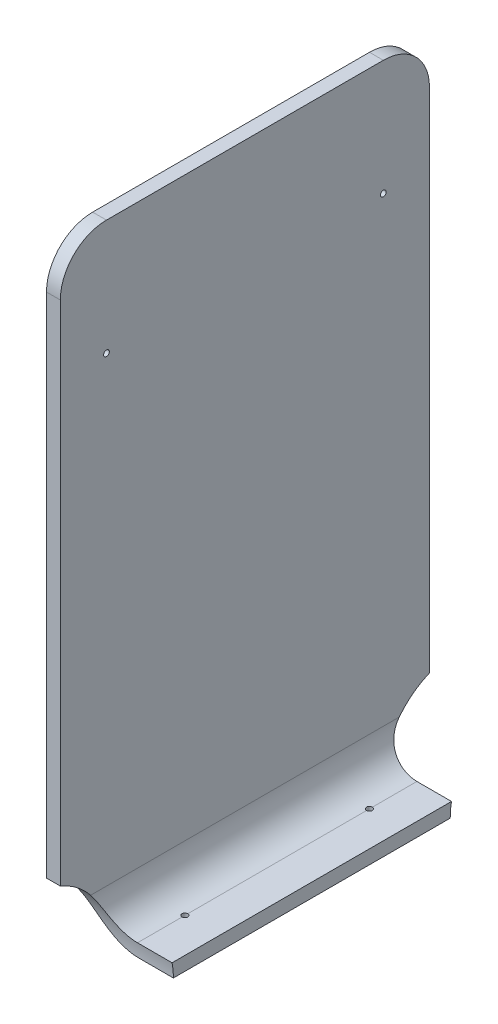
from build123d import *

# Parameters (mm, degrees)
EXTRUDE_THIN1_DEPTH     = 101.6
FILLET1_R               = 25.4
FILLET2_R               = 25.4
CUT_EXTRUDE1_DEPTH      = 15.494
CUT_EXTRUDE1_DEPTH_BACK = 67.818
CUT_EXTRUDE2_DEPTH      = 20.32
CUT_EXTRUDE2_DEPTH_BACK = 16.51
SKETCH3_R               = 1.5875
CUT_EXTRUDE3_DEPTH      = 14.732
CUT_EXTRUDE3_DEPTH_BACK = 22.86
SKETCH4_R               = 1.5875


with BuildPart() as part:
    # Sketch1 → Extrude-Thin1 (new, symmetric)
    with BuildSketch(Plane.XY):
        with BuildLine():
            Line((0, 0), (-19.05, 0))
            ThreePointArc((-19.05, 0), (-37.010512242, 7.439487758), (-44.45, 25.4))
            Line((-44.45, 25.4), (-44.45, 342.9))
            Line((-44.45, 342.9), (-36.83, 342.9))
            Line((-36.83, 342.9), (-36.83, 25.4))
            ThreePointArc((-36.83, 25.4), (-31.622358569, 12.827641431), (-19.05, 7.62))
            Line((-19.05, 7.62), (0, 7.62))
            Line((0, 7.62), (0, 0))
        make_face()
    extrude(amount=EXTRUDE_THIN1_DEPTH, both=True)

    # Fillet1
    fillet1_edges = [part.edges().sort_by_distance(p)[0] for p in [
        (-40.64, 342.9, 101.6),
    ]]
    fillet(fillet1_edges, radius=FILLET1_R)

    # Fillet2
    fillet2_edges = [part.edges().sort_by_distance(p)[0] for p in [
        (-40.64, 342.9, -101.6),
    ]]
    fillet(fillet2_edges, radius=FILLET2_R)

    # Sketch2 → Cut-Extrude1 (cut, two sides: drawn at the far end of the back side and taken through both)
    with BuildSketch(Plane(origin=(0, 0, 0), x_dir=(0, 0, -1), z_dir=(1, 0, 0)).offset(-CUT_EXTRUDE1_DEPTH_BACK)):
        with BuildLine():
            Line((-101.6, 0), (-76.2, 0))
            ThreePointArc((-76.2, 0), (-83.132124101, 22.895250599), (-101.6, 38.1))
            Line((-101.6, 38.1), (-101.6, 0))
        make_face()
        with BuildLine():
            Line((101.6, 0), (101.6, 38.1))
            ThreePointArc((101.6, 38.1), (83.132124101, 22.895250599), (76.2, 0))
            Line((76.2, 0), (101.6, 0))
        make_face()
    extrude(amount=CUT_EXTRUDE1_DEPTH + CUT_EXTRUDE1_DEPTH_BACK, mode=Mode.SUBTRACT)

    # Sketch3 → Cut-Extrude2 (cut, two sides: drawn at the far end of the back side and taken through both)
    with BuildSketch(Plane(origin=(-36.83, 0, 0), x_dir=(0, 0, -1), z_dir=(1, 0, 0)).offset(-CUT_EXTRUDE2_DEPTH_BACK)):
        with Locations(Location((-76.2, 279.4, 0), (0, 0, 180))):
            Circle(SKETCH3_R)
        with Locations(Location((76.2, 279.4, 0), (0, 0, 180))):
            Circle(SKETCH3_R)
    extrude(amount=CUT_EXTRUDE2_DEPTH + CUT_EXTRUDE2_DEPTH_BACK, mode=Mode.SUBTRACT)

    # Sketch4 → Cut-Extrude3 (cut, two sides: drawn at the far end of the back side and taken through both)
    with BuildSketch(Plane(origin=(0, 7.62, 0), x_dir=(1, 0, 0), z_dir=(0, 1, 0)).offset(-CUT_EXTRUDE3_DEPTH_BACK)):
        with Locations(Location((-19.05, -50.8, 0), (0, 0, 270))):
            Circle(SKETCH4_R)
        with Locations(Location((-19.05, 50.8, 0), (0, 0, 270))):
            Circle(SKETCH4_R)
    extrude(amount=CUT_EXTRUDE3_DEPTH + CUT_EXTRUDE3_DEPTH_BACK, mode=Mode.SUBTRACT)


solid = part.part
